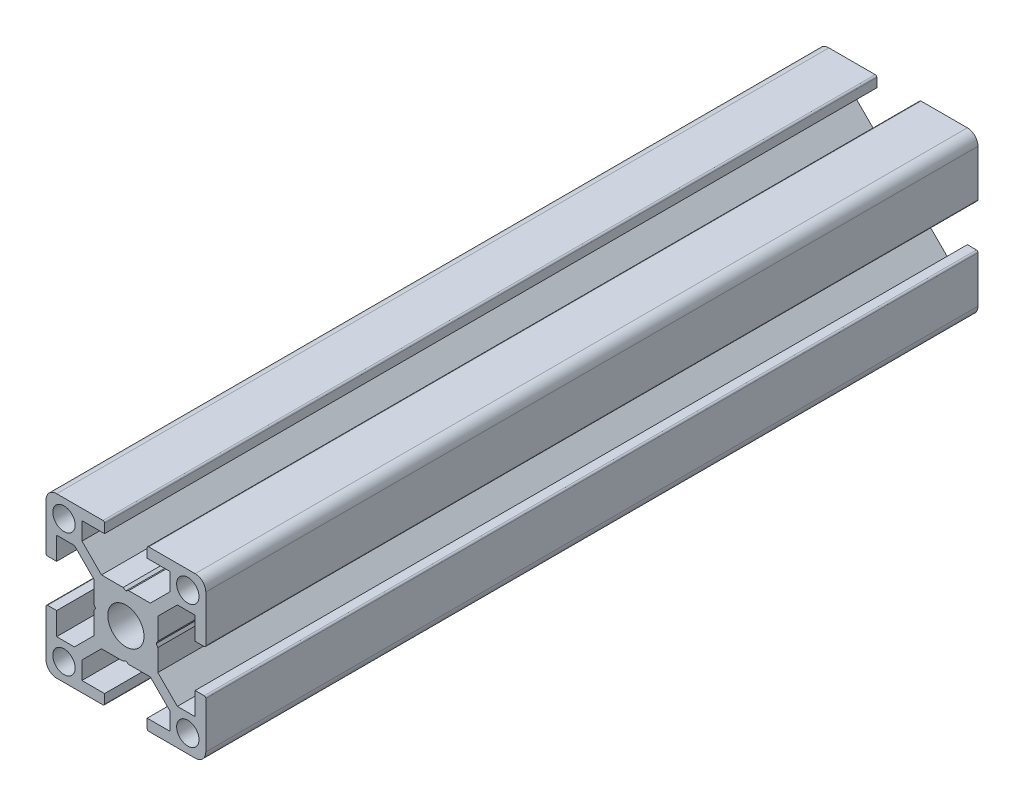
from build123d import *

# Parameters (mm, degrees)
SKETCH1_R           = 2.1
SKETCH1_R_2         = 3.4
BOSS_EXTRUDE1_DEPTH = 145


with BuildPart() as part:
    # Sketch1 → Boss-Extrude1 (new body)
    with BuildSketch(Plane.XY):
        with BuildLine():
            Line((-14.7, 4), (-13, 4))
            Line((-13, 4), (-13, 8.25))
            Line((-13, 8.25), (-9.664213562, 8.25))
            Line((-9.664213562, 8.25), (-6, 4.585786438))
            Line((-6, 4.585786438), (-6, 0.519615242))
            Line((-6, 0.519615242), (-5.7, 0))
            Line((-5.7, 0), (-6, -0.519615242))
            Line((-6, -0.519615242), (-6, -4.585786438))
            Line((-6, -4.585786438), (-9.664213562, -8.25))
            Line((-9.664213562, -8.25), (-13, -8.25))
            Line((-13, -8.25), (-13, -4))
            Line((-13, -4), (-14.7, -4))
            ThreePointArc((-14.7, -4), (-14.912132034, -4.087867966), (-15, -4.3))
            Line((-15, -4.3), (-15, -13))
            ThreePointArc((-15, -13), (-14.414213562, -14.414213562), (-13, -15))
            Line((-13, -15), (-4.3, -15))
            ThreePointArc((-4.3, -15), (-4.087867966, -14.912132034), (-4, -14.7))
            Line((-4, -14.7), (-4, -13))
            Line((-4, -13), (-8.25, -13))
            Line((-8.25, -13), (-8.25, -9.664213562))
            Line((-8.25, -9.664213562), (-4.585786438, -6))
            Line((-4.585786438, -6), (-0.519615242, -6))
            Line((-0.519615242, -6), (0, -5.7))
            Line((0, -5.7), (0.519615242, -6))
            Line((0.519615242, -6), (4.585786438, -6))
            Line((4.585786438, -6), (8.25, -9.664213562))
            Line((8.25, -9.664213562), (8.25, -13))
            Line((8.25, -13), (4, -13))
            Line((4, -13), (4, -14.7))
            ThreePointArc((4, -14.7), (4.087867966, -14.912132034), (4.3, -15))
            Line((4.3, -15), (13, -15))
            ThreePointArc((13, -15), (14.414213562, -14.414213562), (15, -13))
            Line((15, -13), (15, -4.3))
            ThreePointArc((15, -4.3), (14.912132034, -4.087867966), (14.7, -4))
            Line((14.7, -4), (13, -4))
            Line((13, -4), (13, -8.25))
            Line((13, -8.25), (9.664213562, -8.25))
            Line((9.664213562, -8.25), (6, -4.585786438))
            Line((6, -4.585786438), (6, -0.519615242))
            Line((6, -0.519615242), (5.7, 0))
            Line((5.7, 0), (6, 0.519615242))
            Line((6, 0.519615242), (6, 4.585786438))
            Line((6, 4.585786438), (9.664213562, 8.25))
            Line((9.664213562, 8.25), (13, 8.25))
            Line((13, 8.25), (13, 4))
            Line((13, 4), (14.7, 4))
            ThreePointArc((14.7, 4), (14.912132034, 4.087867966), (15, 4.3))
            Line((15, 4.3), (15, 13))
            ThreePointArc((15, 13), (14.414213562, 14.414213562), (13, 15))
            Line((13, 15), (4.3, 15))
            ThreePointArc((4.3, 15), (4.087867966, 14.912132034), (4, 14.7))
            Line((4, 14.7), (4, 13))
            Line((4, 13), (8.25, 13))
            Line((8.25, 13), (8.25, 9.664213562))
            Line((8.25, 9.664213562), (4.585786438, 6))
            Line((4.585786438, 6), (0.519615242, 6))
            Line((0.519615242, 6), (0, 5.7))
            Line((0, 5.7), (-0.519615242, 6))
            Line((-0.519615242, 6), (-4.585786438, 6))
            Line((-4.585786438, 6), (-8.25, 9.664213562))
            Line((-8.25, 9.664213562), (-8.25, 13))
            Line((-8.25, 13), (-4, 13))
            Line((-4, 13), (-4, 14.7))
            ThreePointArc((-4, 14.7), (-4.087867966, 14.912132034), (-4.3, 15))
            Line((-4.3, 15), (-13, 15))
            ThreePointArc((-13, 15), (-14.414213562, 14.414213562), (-15, 13))
            Line((-15, 13), (-15, 4.3))
            ThreePointArc((-15, 4.3), (-14.912132034, 4.087867966), (-14.7, 4))
        make_face()
        with Locations((11.625, 11.625)):
            Circle(SKETCH1_R, mode=Mode.SUBTRACT)
        with Locations((11.625, -11.625)):
            Circle(SKETCH1_R, mode=Mode.SUBTRACT)
        Circle(SKETCH1_R_2, mode=Mode.SUBTRACT)
        with Locations((-11.625, -11.625)):
            Circle(SKETCH1_R, mode=Mode.SUBTRACT)
        with Locations((-11.625, 11.625)):
            Circle(SKETCH1_R, mode=Mode.SUBTRACT)
    extrude(amount=BOSS_EXTRUDE1_DEPTH)


solid = part.part
